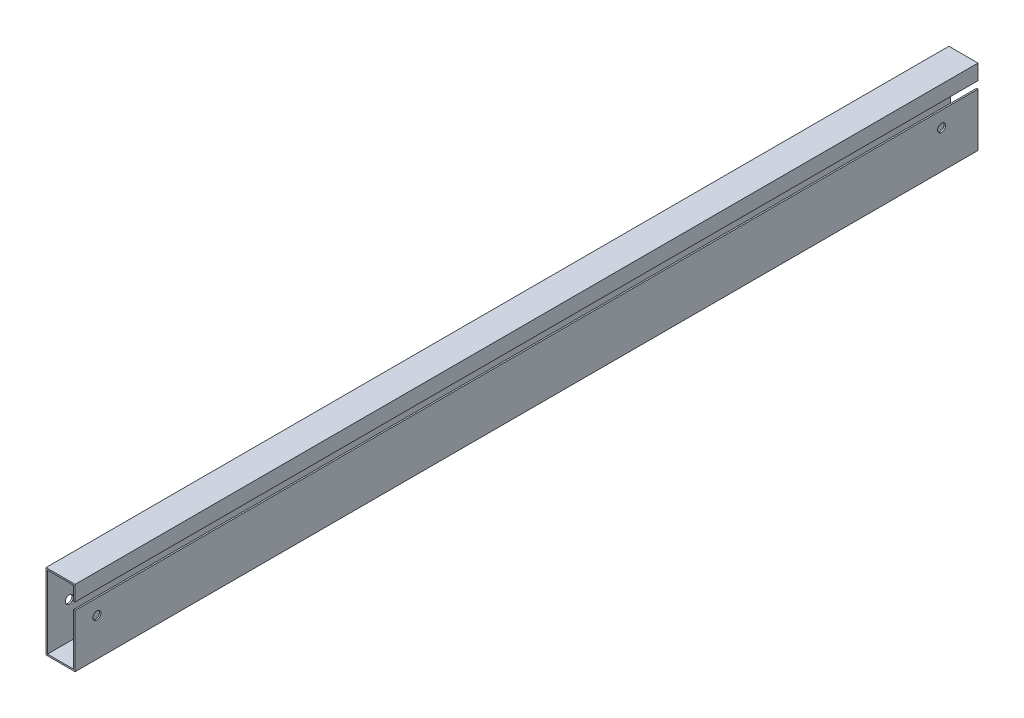
from build123d import *

# Parameters (mm, degrees)
SKETCH1_W           = 20
SKETCH1_H           = 52
BOSS_EXTRUDE1_DEPTH = 620
SKETCH2_W           = 18
SKETCH2_H           = 50
CUT_EXTRUDE1_DEPTH  = 1200
SKETCH4_R           = 2.75
CUT_EXTRUDE2_DEPTH  = 20
SKETCH5_W           = 1
SKETCH5_H           = 5
CUT_EXTRUDE3_DEPTH  = 1200
SKETCH6_R           = 2.75
CUT_EXTRUDE4_DEPTH  = 20


with BuildPart() as part:
    # Sketch1 → Boss-Extrude1 (new body)
    with BuildSketch(Plane.XY):
        Rectangle(SKETCH1_W, SKETCH1_H)
    extrude(amount=-BOSS_EXTRUDE1_DEPTH)

    # Sketch2 → Cut-Extrude1 (cut)
    with BuildSketch(Plane.XY):
        Rectangle(SKETCH2_W, SKETCH2_H)
    extrude(amount=-CUT_EXTRUDE1_DEPTH, mode=Mode.SUBTRACT)

    # Sketch4 → Cut-Extrude2 (cut)
    with BuildSketch(Plane(origin=(10, 0, 0), x_dir=(0, 0, -1), z_dir=(1, 0, 0))):
        with Locations(Location((15, 0, 0), (0, 0, 90))):
            Circle(SKETCH4_R)
    extrude(amount=-CUT_EXTRUDE2_DEPTH, mode=Mode.SUBTRACT)

    # Sketch5 → Cut-Extrude3 (cut)
    with BuildSketch(Plane.XY):
        with Locations((9.5, 13)):
            Rectangle(SKETCH5_W, SKETCH5_H)
    extrude(amount=-CUT_EXTRUDE3_DEPTH, mode=Mode.SUBTRACT)

    # Sketch6 → Cut-Extrude4 (cut)
    with BuildSketch(Plane(origin=(10, 0, 0), x_dir=(0, 0, -1), z_dir=(1, 0, 0))):
        with Locations(Location((595, 0, 0), (0, 0, 90))):
            Circle(SKETCH6_R)
    extrude(amount=-CUT_EXTRUDE4_DEPTH, mode=Mode.SUBTRACT)


solid = part.part
